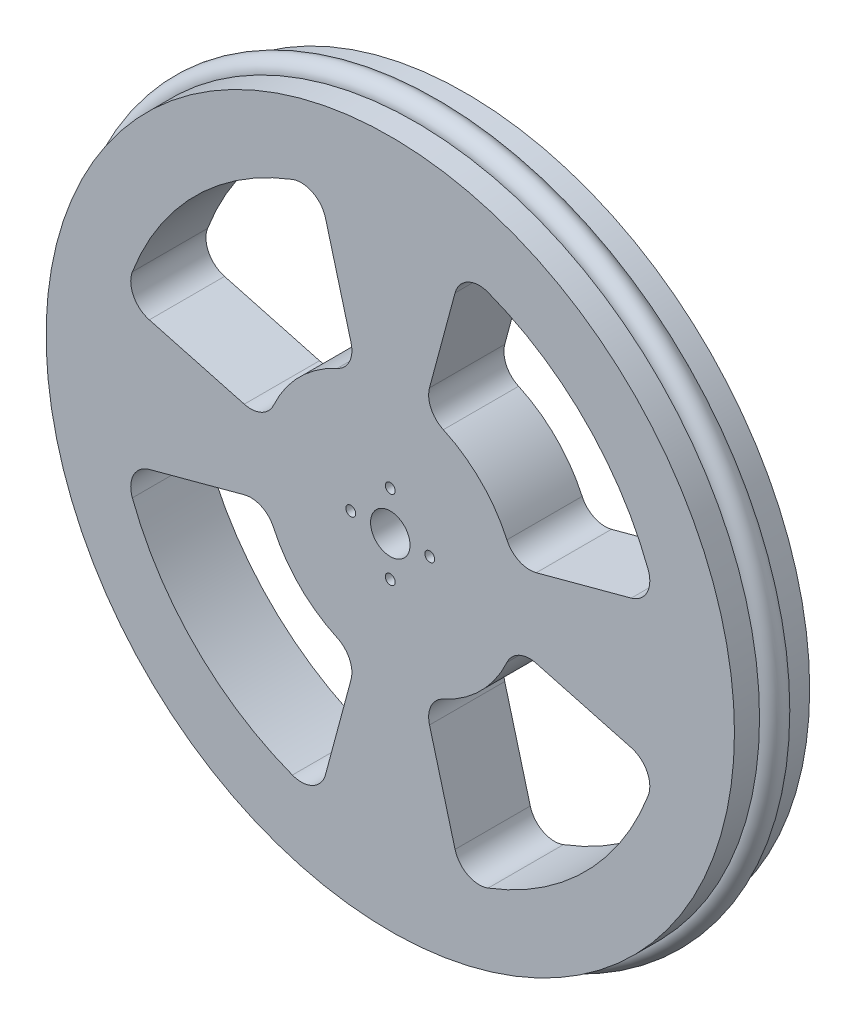
from build123d import *

# Parameters (mm, degrees)
SKETCH1_R           = 63.5
SKETCH1_R_2         = 4
BOSS_EXTRUDE1_DEPTH = 5.08
SKETCH2_R           = 69.720778164
SKETCH2_R_2         = 4
BOSS_EXTRUDE2_DEPTH = 5.08
SKETCH4_R           = 1
CUT_EXTRUDE1_DEPTH  = 100.770894631
CUT_EXTRUDE2_DEPTH  = 104.322300355


with BuildPart() as part:
    # Sketch1 → Boss-Extrude1 (new body)
    with BuildSketch(Plane.XY):
        Circle(SKETCH1_R)
        Circle(SKETCH1_R_2, mode=Mode.SUBTRACT)
    extrude(amount=BOSS_EXTRUDE1_DEPTH)

    # Sketch2 → Boss-Extrude2 (add)
    with BuildSketch(Plane.XY.offset(5.08)):
        Circle(SKETCH2_R)
        Circle(SKETCH2_R_2, mode=Mode.SUBTRACT)
    boss_extrude2 = extrude(amount=BOSS_EXTRUDE2_DEPTH)

    # Mirror1: Boss-Extrude2 across plane
    add(boss_extrude2.mirror(Plane(origin=(0, 0, 2.54), x_dir=(1, 0, 0), z_dir=(0, 0, -1))))

    # Sketch4 → Cut-Extrude1 (cut, through all)
    with BuildSketch(Plane(origin=(0, 0, -5.08), x_dir=(-1, 0, 0), z_dir=(0, 0, -1))):
        with Locations((0, 8)):
            Circle(SKETCH4_R)
        with Locations((8, 0)):
            Circle(SKETCH4_R)
        with Locations((0, -8)):
            Circle(SKETCH4_R)
        with Locations((-8, 0)):
            Circle(SKETCH4_R)
    extrude(amount=-CUT_EXTRUDE1_DEPTH, mode=Mode.SUBTRACT)

    # Sketch5 → Revolve1 (revolve)
    with BuildSketch(Plane(origin=(0, 0, 0), x_dir=(0, 0, -1), z_dir=(1, 0, 0)), mode=Mode.PRIVATE) as revolve1_sk:
        with BuildLine():
            Line((-2.54, 63.5), (0, 63.5))
            Line((0, 63.5), (0, 69.720778164))
            ThreePointArc((0, 69.720778164), (-2.54, 72.260778164), (-5.08, 69.720778164))
            Line((-5.08, 69.720778164), (-5.08, 63.5))
            Line((-5.08, 63.5), (-2.54, 63.5))
        make_face()
    revolve(revolve1_sk.sketch.rotate(Axis((0, 0, 5.08), (0, 0, -1)), 90), axis=Axis((0, 0, 5.08), (0, 0, -1)))

    # Sketch6 → Cut-Extrude2 (cut, through all)
    with BuildSketch(Plane(origin=(0, 0, -5.08), x_dir=(-1, 0, 0), z_dir=(0, 0, -1))):
        with BuildLine():
            Line((-7.948419394, -29.571461023), (-13.119997628, -48.811905768))
            ThreePointArc((-13.119997628, -48.811905768), (-15.712841169, -52.016134189), (-19.828493104, -52.242687832))
            ThreePointArc((-19.828493104, -52.242687832), (-39.512451016, -39.512451016), (-52.242687832, -19.828493104))
            ThreePointArc((-52.242687832, -19.828493104), (-52.016134189, -15.712841169), (-48.811905768, -13.119997628))
            Line((-48.811905768, -13.119997628), (-29.571461023, -7.948419394))
            ThreePointArc((-29.571461023, -7.948419394), (-26.086220535, -8.259490359), (-23.628911169, -10.750533731))
            ThreePointArc((-23.628911169, -10.750533731), (-18.356189944, -18.356189944), (-10.750533731, -23.628911169))
            ThreePointArc((-10.750533731, -23.628911169), (-8.259490359, -26.086220535), (-7.948419394, -29.571461023))
        make_face()
        with BuildLine():
            Line((-29.571461023, 7.948419394), (-48.811905768, 13.119997628))
            ThreePointArc((-48.811905768, 13.119997628), (-52.016134189, 15.712841169), (-52.242687832, 19.828493104))
            ThreePointArc((-52.242687832, 19.828493104), (-39.512451016, 39.512451016), (-19.828493104, 52.242687832))
            ThreePointArc((-19.828493104, 52.242687832), (-15.712841169, 52.016134189), (-13.119997628, 48.811905768))
            Line((-13.119997628, 48.811905768), (-7.948419394, 29.571461023))
            ThreePointArc((-7.948419394, 29.571461023), (-8.259490359, 26.086220535), (-10.750533731, 23.628911169))
            ThreePointArc((-10.750533731, 23.628911169), (-18.356189944, 18.356189944), (-23.628911169, 10.750533731))
            ThreePointArc((-23.628911169, 10.750533731), (-26.086220535, 8.259490359), (-29.571461023, 7.948419394))
        make_face()
        with BuildLine():
            ThreePointArc((19.828493104, 52.242687832), (15.712841169, 52.016134189), (13.119997628, 48.811905768))
            Line((13.119997628, 48.811905768), (7.948419394, 29.571461023))
            ThreePointArc((7.948419394, 29.571461023), (8.259490359, 26.086220535), (10.750533731, 23.628911169))
            ThreePointArc((10.750533731, 23.628911169), (14.790224409, 21.334213847), (18.356189944, 18.356189944))
            Line((18.356189944, 18.356189944), (39.512451016, 39.512451016))
            ThreePointArc((39.512451016, 39.512451016), (30.345537475, 46.921380266), (19.828493104, 52.242687832))
        make_face()
        with BuildLine():
            ThreePointArc((52.242687832, 19.828493104), (46.921380266, 30.345537475), (39.512451016, 39.512451016))
            Line((39.512451016, 39.512451016), (18.356189944, 18.356189944))
            ThreePointArc((18.356189944, 18.356189944), (21.334213847, 14.790224409), (23.628911169, 10.750533731))
            ThreePointArc((23.628911169, 10.750533731), (26.086220535, 8.259490359), (29.571461023, 7.948419394))
            Line((29.571461023, 7.948419394), (48.811905768, 13.119997628))
            ThreePointArc((48.811905768, 13.119997628), (52.016134189, 15.712841169), (52.242687832, 19.828493104))
        make_face()
        with BuildLine():
            Line((29.571461023, -7.948419394), (48.811905768, -13.119997628))
            ThreePointArc((48.811905768, -13.119997628), (52.016134189, -15.712841169), (52.242687832, -19.828493104))
            ThreePointArc((52.242687832, -19.828493104), (39.512451016, -39.512451016), (19.828493104, -52.242687832))
            ThreePointArc((19.828493104, -52.242687832), (15.712841169, -52.016134189), (13.119997628, -48.811905768))
            Line((13.119997628, -48.811905768), (7.948419394, -29.571461023))
            ThreePointArc((7.948419394, -29.571461023), (8.259490359, -26.086220535), (10.750533731, -23.628911169))
            ThreePointArc((10.750533731, -23.628911169), (18.356189944, -18.356189944), (23.628911169, -10.750533731))
            ThreePointArc((23.628911169, -10.750533731), (26.086220535, -8.259490359), (29.571461023, -7.948419394))
        make_face()
    extrude(amount=-CUT_EXTRUDE2_DEPTH, mode=Mode.SUBTRACT)


solid = part.part
